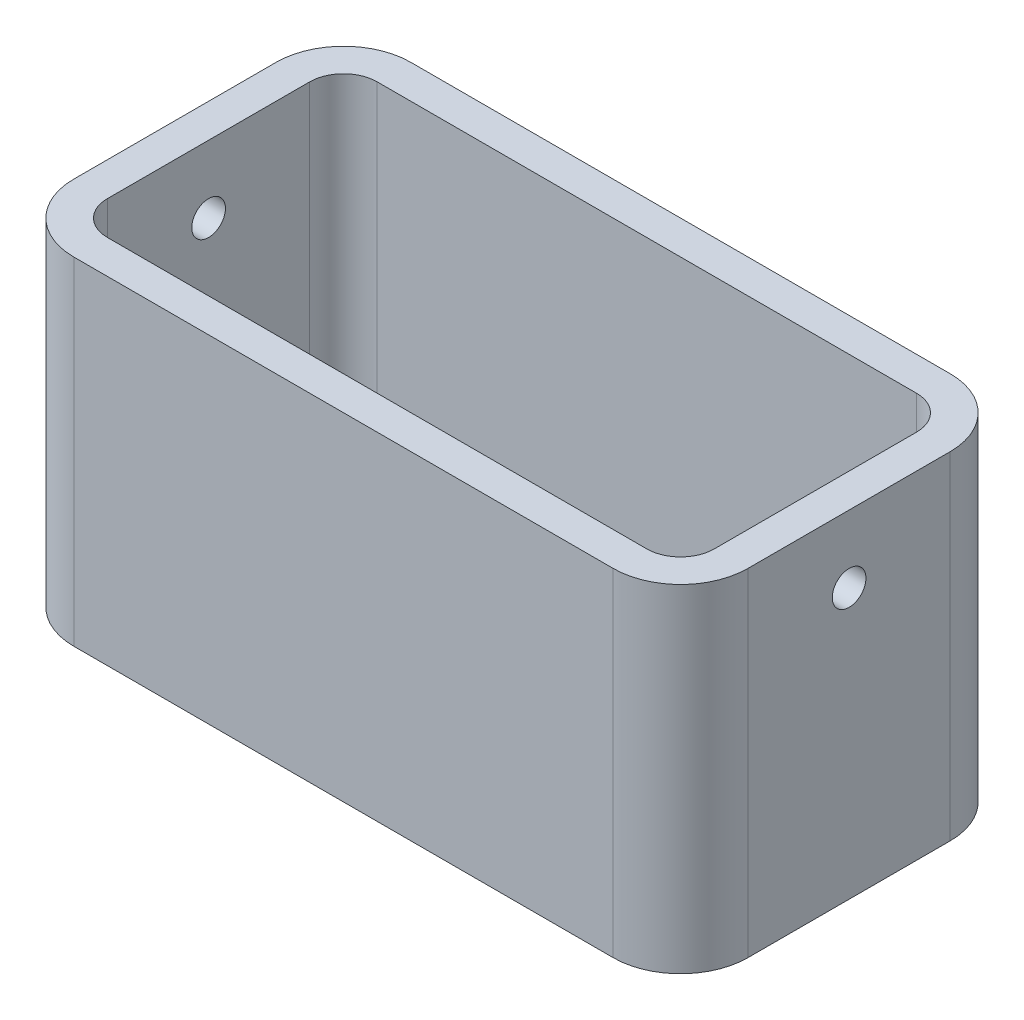
from build123d import *

# Parameters (mm, degrees)
SKETCH1_W           = 100
SKETCH1_H           = 50
BOSS_EXTRUDE1_DEPTH = 50
FILLET1_R           = 10
SHELL1_T            = -5
SKETCH2_R           = 2.5
CUT_EXTRUDE1_DEPTH  = 115.564392374


with BuildPart() as part:
    # Sketch1 → Boss-Extrude1 (new body)
    with BuildSketch(Plane(origin=(0, 0, 0), x_dir=(1, 0, 0), z_dir=(0, 1, 0))):
        Rectangle(SKETCH1_W, SKETCH1_H)
    extrude(amount=BOSS_EXTRUDE1_DEPTH)

    # Fillet1
    fillet1_edges = [part.edges().sort_by_distance(p)[0] for p in [
        (-50, 25, -25),
        (50, 25, -25),
        (50, 25, 25),
        (-50, 25, 25),
    ]]
    fillet(fillet1_edges, radius=FILLET1_R)

    # Shell1
    shell1_openings = [part.faces().sort_by_distance(p)[0] for p in [
        (0, 50, 0),
    ]]
    offset(amount=SHELL1_T, openings=shell1_openings, kind=Kind.INTERSECTION)

    # Sketch2 → Cut-Extrude1 (cut, through all)
    with BuildSketch(Plane(origin=(50, 0, 0), x_dir=(0, 0, -1), z_dir=(1, 0, 0))):
        with Locations((0, 40)):
            Circle(SKETCH2_R)
    extrude(amount=-CUT_EXTRUDE1_DEPTH, mode=Mode.SUBTRACT)


solid = part.part
